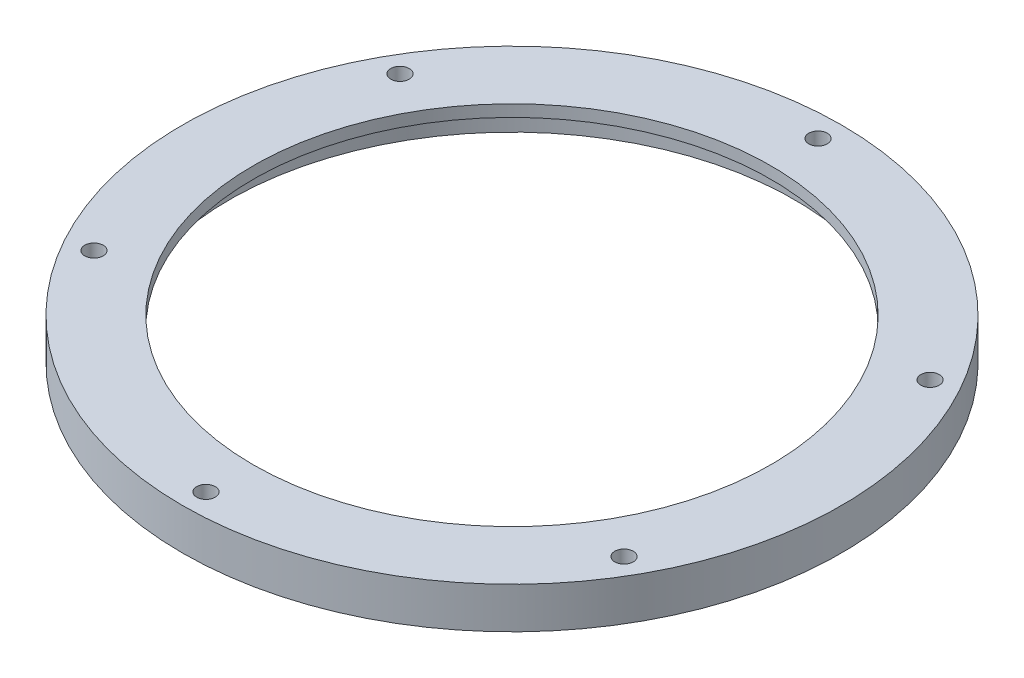
from build123d import *

# Parameters (mm, degrees)
SKETCH1_R           = 88.9
SKETCH1_R_2         = 76.2
BOSS_EXTRUDE1_DEPTH = 7.9375
SKETCH2_R           = 88.9
SKETCH2_R_2         = 69.85
BOSS_EXTRUDE2_DEPTH = 3.175
SKETCH3_R           = 2.5
CUT_EXTRUDE1_DEPTH  = 127.213737985
CIRPATTERN1_COUNT   = 6


with BuildPart() as part:
    # Sketch1 → Boss-Extrude1 (new body)
    with BuildSketch(Plane(origin=(0, 0, 0), x_dir=(1, 0, 0), z_dir=(0, 1, 0))):
        with Locations(Location((0, 0, 0), (0, 0, 270))):
            Circle(SKETCH1_R)
        with Locations(Location((0, 0, 0), (0, 0, 270))):
            Circle(SKETCH1_R_2, mode=Mode.SUBTRACT)
    extrude(amount=BOSS_EXTRUDE1_DEPTH)

    # Sketch2 → Boss-Extrude2 (add)
    with BuildSketch(Plane(origin=(0, 7.9375, 0), x_dir=(1, 0, 0), z_dir=(0, 1, 0))):
        with Locations(Location((0, 0, 0), (0, 0, 270))):
            Circle(SKETCH2_R)
        with Locations(Location((0, 0, 0), (0, 0, 270))):
            Circle(SKETCH2_R_2, mode=Mode.SUBTRACT)
    extrude(amount=BOSS_EXTRUDE2_DEPTH)

    # Sketch3 → Cut-Extrude1 (cut, through all)
    with BuildSketch(Plane(origin=(0, 11.1125, 0), x_dir=(1, 0, 0), z_dir=(0, 1, 0))):
        with Locations(Location((0, 82.55, 0), (0, 0, 270))):
            Circle(SKETCH3_R)
    cut_extrude1 = extrude(amount=-CUT_EXTRUDE1_DEPTH, mode=Mode.SUBTRACT)

    # CirPattern1: Cut-Extrude1 ×6 about axis
    cirpattern1_axis = Axis((0, 0, 0), (0, 1, 0))
    for i in range(1, CIRPATTERN1_COUNT):
        add(cut_extrude1.rotate(cirpattern1_axis, i * 360 / CIRPATTERN1_COUNT), mode=Mode.SUBTRACT)


solid = part.part
